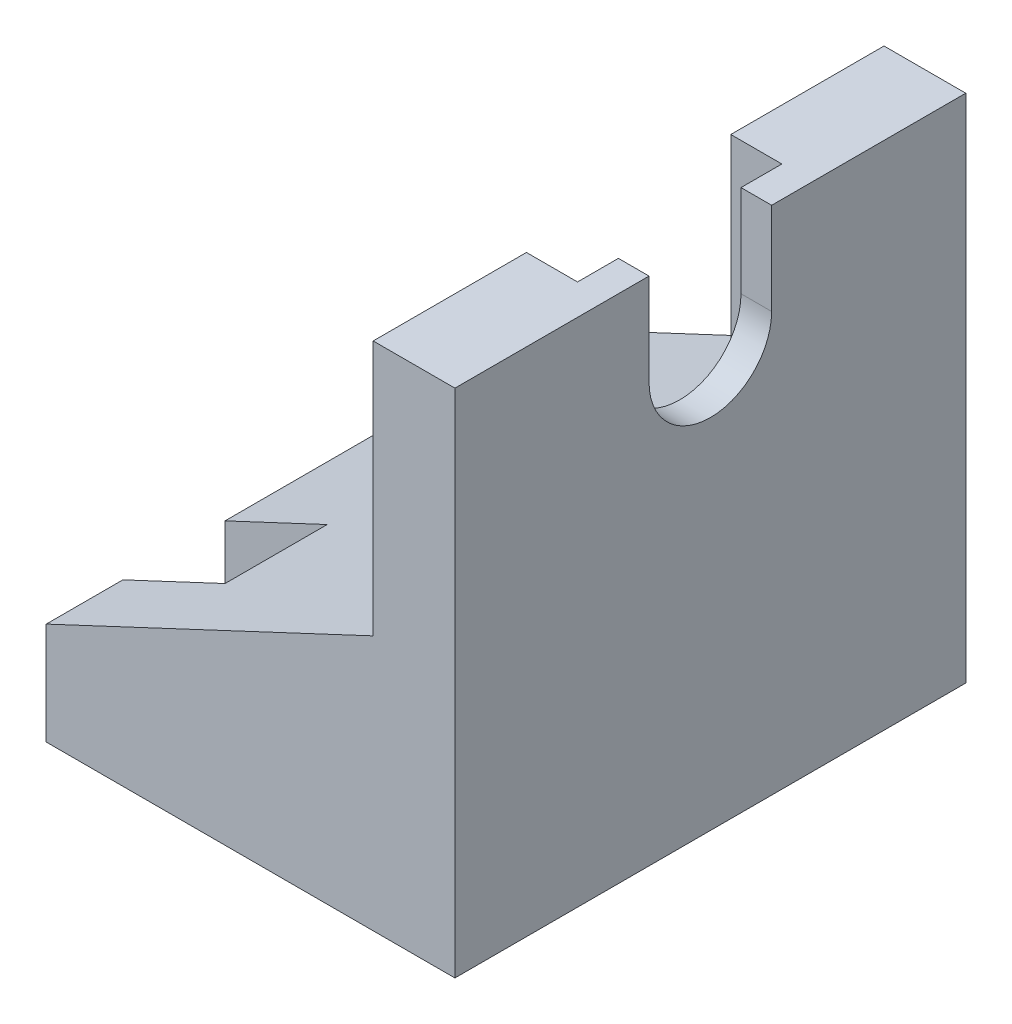
from build123d import *

# Parameters (mm, degrees)
EXTRUDE_1_DEPTH          = 50
SKETCH_2_W               = 10
SKETCH_2_H               = 10
CUT_EXTRUDE_1_DEPTH      = 74.484692283
CUT_EXTRUDE_2_DEPTH      = 50
CUT_EXTRUDE_3_DEPTH      = 10
CUT_EXTRUDE_3_DEPTH_BACK = 10


with BuildPart() as part:
    # Эскиз1 → Бобышка-Вытянуть1 (new body)
    with BuildSketch(Plane.XY):
        Polygon((20, 25), (12, 25), (12, 0), (-20, -15), (-20, -25), (20, -25), align=None)
    extrude(amount=EXTRUDE_1_DEPTH)

    # Эскиз2 → Вырез-Вытянуть1 (cut, through all)
    with BuildSketch(Plane.XZ.offset(25)):
        with Locations((-15, 12.5)):
            Rectangle(SKETCH_2_W, SKETCH_2_H)
        with Locations((-15, 37.5)):
            Rectangle(SKETCH_2_W, SKETCH_2_H)
    extrude(amount=-CUT_EXTRUDE_1_DEPTH, mode=Mode.SUBTRACT)

    # Эскиз3 → Вырез-Вытянуть2 (cut)
    with BuildSketch(Plane(origin=(20, 0, 0), x_dir=(0, 0, -1), z_dir=(1, 0, 0))):
        with BuildLine():
            Line((-19, 25), (-25, 25))
            Line((-25, 25), (-25, 22))
            ThreePointArc((-25, 22), (-20.757359313, 20.242640687), (-19, 16))
            Line((-19, 16), (-19, 25))
        make_face()
        with BuildLine():
            ThreePointArc((-19, 16), (-20.757359313, 20.242640687), (-25, 22))
            Line((-25, 22), (-25, 10))
            ThreePointArc((-25, 10), (-20.757359313, 11.757359313), (-19, 16))
        make_face()
        with BuildLine():
            Line((-25, 10), (-25, 22))
            ThreePointArc((-25, 22), (-29.242640687, 20.242640687), (-31, 16))
            ThreePointArc((-31, 16), (-29.242640687, 11.757359313), (-25, 10))
        make_face()
        with BuildLine():
            Line((-25, 22), (-25, 25))
            Line((-25, 25), (-31, 25))
            Line((-31, 25), (-31, 16))
            ThreePointArc((-31, 16), (-29.242640687, 20.242640687), (-25, 22))
        make_face()
    extrude(amount=-CUT_EXTRUDE_2_DEPTH, mode=Mode.SUBTRACT)

    # Эскиз4 → Вырез-Вытянуть3 (cut, two sides: drawn at the far end of the back side and taken through both)
    with BuildSketch(Plane.XY.offset(25).offset(-CUT_EXTRUDE_3_DEPTH_BACK)):
        Polygon((12, 25), (12, 5), (17, 8), (17, 25), align=None)
    extrude(amount=CUT_EXTRUDE_3_DEPTH + CUT_EXTRUDE_3_DEPTH_BACK, mode=Mode.SUBTRACT)


solid = part.part
